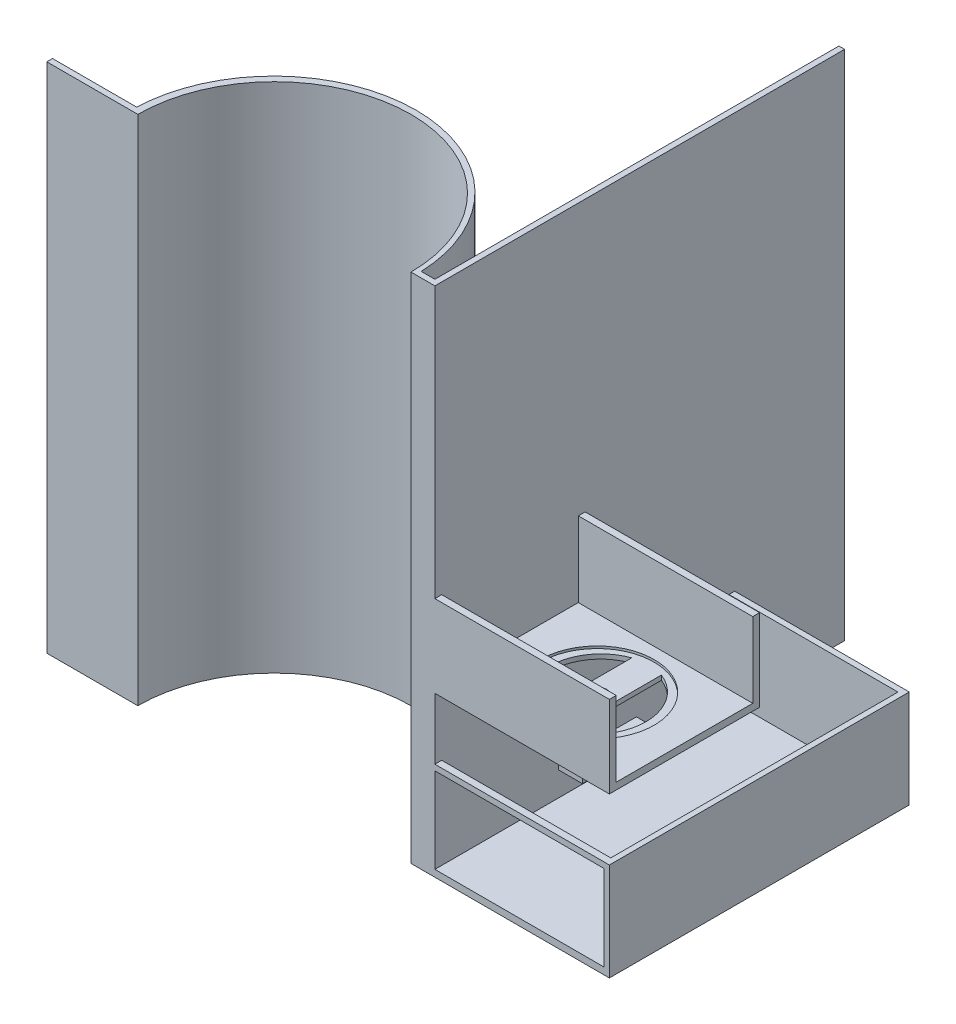
from build123d import *

# Parameters (mm, degrees)
EXTRUDE_1_DEPTH     = 225
SKETCH_3_W          = 66
SKETCH_3_H          = 76.655878063
EXTRUDE_2_DEPTH     = 3
SKETCH_4_W          = 76.655878063
SKETCH_4_H          = 33
EXTRUDE_3_DEPTH     = 3
SKETCH_5_W          = 76.655878063
SKETCH_5_H          = 33
EXTRUDE_4_DEPTH     = 3
SKETCH_7_R          = 25
CUT_EXTRUDE_1_DEPTH = 1
SKETCH_8_R          = 4.2
CUT_EXTRUDE_2_DEPTH = 3
CUT_EXTRUDE_3_DEPTH = 3
SKETCH_10_W         = 6.167449304
SKETCH_10_H         = 10.561253057
EXTRUDE_5_DEPTH     = 20
SKETCH_11_W         = 10.561253057
SKETCH_11_H         = 34.261699871
EXTRUDE_6_DEPTH     = 3
EXTRUDE_7_DEPTH     = 3
EXTRUDE_8_DEPTH     = 43
SKETCH_15_W         = 76.655878063
SKETCH_15_H         = 2.5
EXTRUDE_9_DEPTH     = 3


with BuildPart() as part:
    # 草图1 → 凸台-拉伸1 (new body)
    with BuildSketch(Plane(origin=(0, 0, 0), x_dir=(1, 0, 0), z_dir=(0, 1, 0))):
        with BuildLine():
            Line((0, 0), (40, 0))
            ThreePointArc((40, 0), (100, 60), (160, 0))
            Line((160, 0), (170.5, 0))
            Line((170.5, 0), (170.5, 180))
            Line((170.5, 180), (168, 180))
            Line((168, 180), (168, 2.5))
            Line((168, 2.5), (162, 2.5))
            ThreePointArc((162, 2.5), (99.5, 62.720665032), (37, 2.5))
            Line((37, 2.5), (0, 2.5))
            Line((0, 2.5), (0, 0))
        make_face()
    extrude(amount=EXTRUDE_1_DEPTH)

    # 草图3 → 凸台-拉伸2 (add)
    with BuildSketch(Plane(origin=(0, 70, 0), x_dir=(0, 0, -1), z_dir=(0, -1, 0))):
        with Locations((33, 208.827939032)):
            Rectangle(SKETCH_3_W, SKETCH_3_H)
    extrude(amount=-EXTRUDE_2_DEPTH)

    # 草图4 → 凸台-拉伸3 (add)
    with BuildSketch(Plane.XY):
        with Locations((208.827939032, 89.5)):
            Rectangle(SKETCH_4_W, SKETCH_4_H)
    extrude(amount=-EXTRUDE_3_DEPTH)

    # 草图5 → 凸台-拉伸4 (add)
    with BuildSketch(Plane(origin=(0, 0, -66), x_dir=(-1, 0, 0), z_dir=(0, 0, -1))):
        with Locations((-208.827939032, 89.5)):
            Rectangle(SKETCH_5_W, SKETCH_5_H)
    extrude(amount=-EXTRUDE_4_DEPTH)

    # 草图7 → 切除-拉伸1 (cut)
    with BuildSketch(Plane(origin=(0, 73, 0), x_dir=(1, 0, 0), z_dir=(0, 1, 0))):
        with Locations(Location((208.827939031, 33, 0), (0, 0, 270))):
            Circle(SKETCH_7_R)
    extrude(amount=-CUT_EXTRUDE_1_DEPTH, mode=Mode.SUBTRACT)

    # 草图8 → 切除-拉伸2 (cut)
    with BuildSketch(Plane(origin=(0, 73, 0), x_dir=(1, 0, 0), z_dir=(0, 1, 0))):
        with Locations(Location((208.827939031, 33, 0), (0, 0, 270))):
            Circle(SKETCH_8_R)
    extrude(amount=-CUT_EXTRUDE_2_DEPTH, mode=Mode.SUBTRACT)

    # 草图9 → 切除-拉伸3 (cut)
    with BuildSketch(Plane(origin=(0, 73, 0), x_dir=(1, 0, 0), z_dir=(0, 1, 0))):
        with BuildLine():
            Line((202.276441695, 38.603794928), (202.276441695, 54.71078199))
            ThreePointArc((202.276441695, 54.71078199), (187.355723059, 33.535648138), (202.276441695, 12.360514285))
            Line((202.276441695, 12.360514285), (202.276441695, 26.245847959))
            Line((202.276441695, 26.245847959), (202.276441695, 38.603794928))
        make_face()
        with BuildLine():
            ThreePointArc((215.331215104, 54.71078199), (229.726697753, 33.535648138), (215.331215104, 12.360514285))
            Line((215.331215104, 12.360514285), (215.331215104, 26.245847959))
            Line((215.331215104, 26.245847959), (215.331215104, 38.603794928))
            Line((215.331215104, 38.603794928), (215.331215104, 54.71078199))
        make_face()
    extrude(amount=-CUT_EXTRUDE_3_DEPTH, mode=Mode.SUBTRACT)

    # 草图10 → 凸台-拉伸5 (add)
    with BuildSketch(Plane(origin=(0, 70, 0), x_dir=(0, 0, -1), z_dir=(0, -1, 0))):
        with Locations((24.097577195, 209.037691234)):
            Rectangle(SKETCH_10_W, SKETCH_10_H)
    extrude(amount=EXTRUDE_5_DEPTH)

    # 草图11 → 凸台-拉伸6 (add)
    with BuildSketch(Plane(origin=(0, 50, 0), x_dir=(-1, 0, 0), z_dir=(0, -1, 0))):
        with Locations((-209.037691234, 38.144702479)):
            Rectangle(SKETCH_11_W, SKETCH_11_H)
    extrude(amount=EXTRUDE_6_DEPTH)

    # 草图12 → 凸台-拉伸7 (add)
    with BuildSketch(Plane(origin=(0, 0, 0), x_dir=(1, 0, 0), z_dir=(0, 1, 0))):
        Polygon((170.5, 0), (247.155878063, 0), (247.205159598, 131.685407984), (170.5, 131.685407984), align=None)
    extrude(amount=EXTRUDE_7_DEPTH)

    # 草图13 → 凸台-拉伸8 (add)
    with BuildSketch(Plane(origin=(0, 0, 0), x_dir=(1, 0, 0), z_dir=(0, 1, 0))):
        Polygon((247.155878063, 0), (247.205159598, 131.685407984), (170.5, 131.685407984), (170.5, 129.185407984), (244.763652704, 129.185407984), (244.763652704, 0), align=None)
    extrude(amount=EXTRUDE_8_DEPTH)

    # 草图15 → 凸台-拉伸9 (add)
    with BuildSketch(Plane.XY):
        with Locations((208.827939032, 41.75)):
            Rectangle(SKETCH_15_W, SKETCH_15_H)
    extrude(amount=-EXTRUDE_9_DEPTH)


solid = part.part
